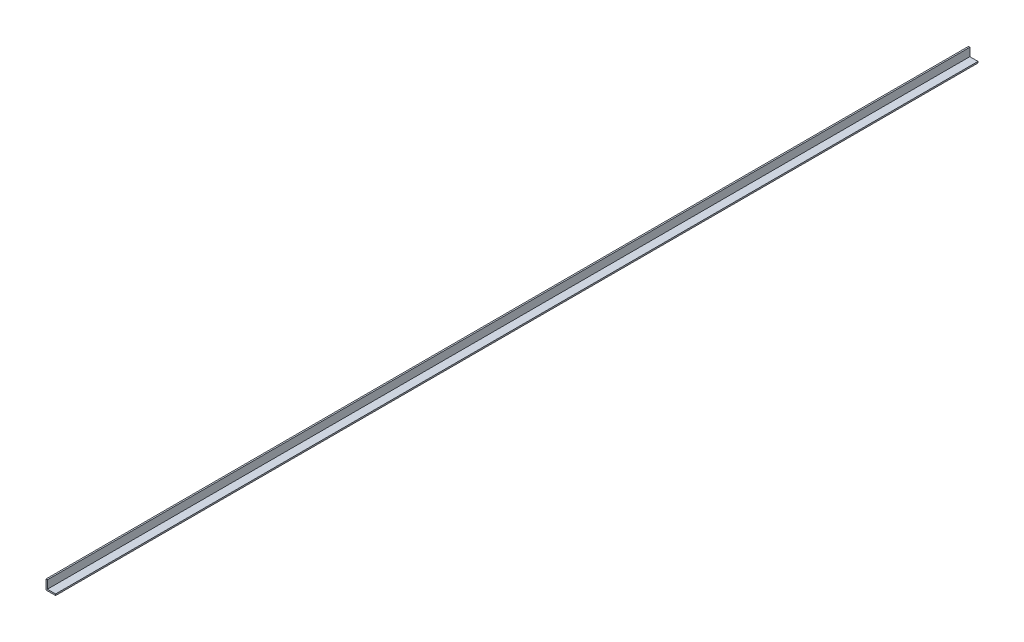
from build123d import *

# Parameters (mm, degrees)
SALIENTE_EXTRUIR1_DEPTH = 6100


with BuildPart() as part:
    # Croquis1 → Saliente-Extruir1 (new body)
    with BuildSketch(Plane.XY):
        Polygon((0, 63.5), (0, 0), (63.5, 0), (63.5, 9.53), (9.53, 9.53), (9.53, 63.5), align=None)
    extrude(amount=-SALIENTE_EXTRUIR1_DEPTH)


solid = part.part
